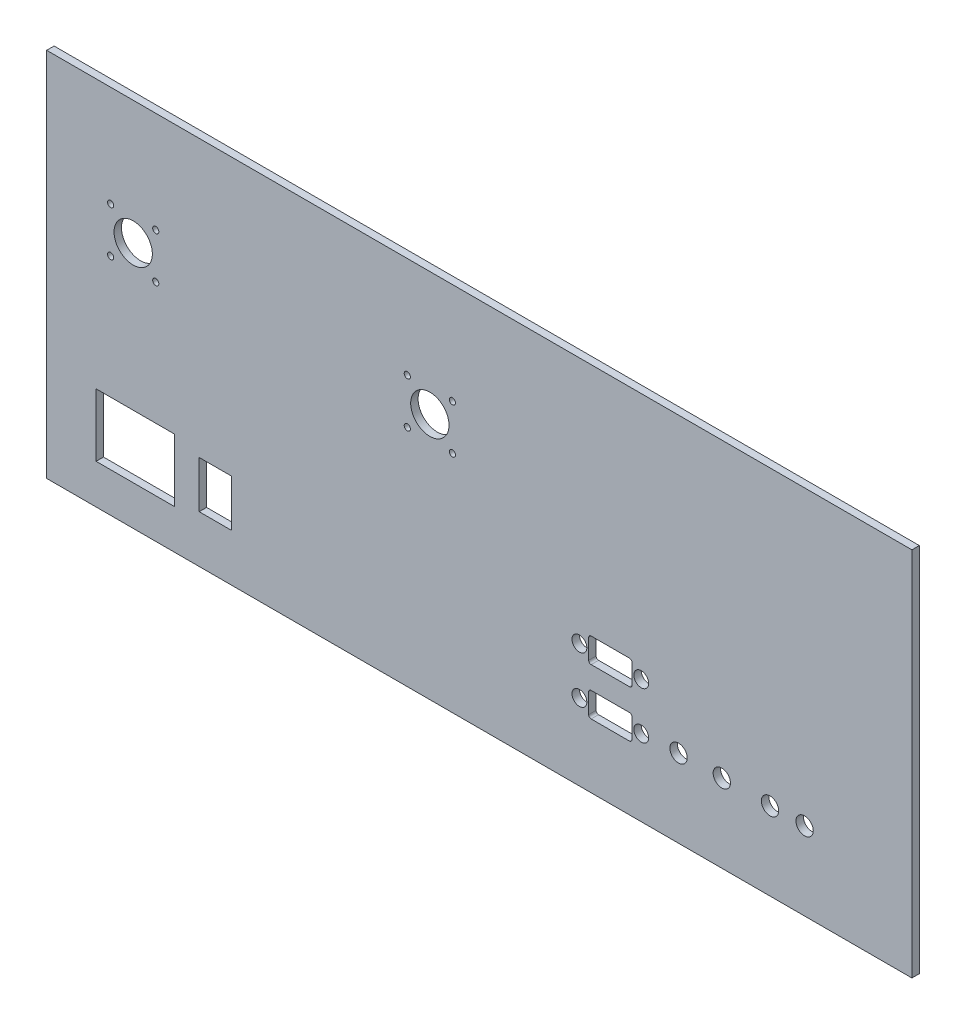
from build123d import *

# Parameters (mm, degrees)
SKETCH_2_W          = 350
SKETCH_2_H          = 150
EXTRUDE_1_DEPTH     = 3
SKETCH_3_R          = 3
SKETCH_3_R_2        = 3.5
SKETCH_3_R_3        = 1.25
SKETCH_3_R_4        = 7.75
SKETCH_3_W          = 31.7
SKETCH_3_H          = 25.4
SKETCH_3_W_2        = 13
SKETCH_3_H_2        = 19
CUT_EXTRUDE_1_DEPTH = 231.508134347


with BuildPart() as part:
    # 草图2 → 凸台-拉伸1 (new body)
    with BuildSketch(Plane.XY):
        with Locations((0, 75)):
            Rectangle(SKETCH_2_W, SKETCH_2_H)
    extrude(amount=EXTRUDE_1_DEPTH)

    # 草图3 → 切除-拉伸1 (cut, through all)
    with BuildSketch(Plane.XY.offset(3)):
        with Locations((40.5, 30.875)):
            Circle(SKETCH_3_R)
        with Locations((65.5, 30.875)):
            Circle(SKETCH_3_R)
        with Locations((80.6, 31.6)):
            Circle(SKETCH_3_R_2)
        with Locations((98.1, 31.6)):
            Circle(SKETCH_3_R_2)
        with Locations((117.6, 31.6)):
            Circle(SKETCH_3_R_2)
        with Locations((131.6, 31.6)):
            Circle(SKETCH_3_R_2)
        with Locations((-149.12, 109.12)):
            Circle(SKETCH_3_R_3)
        with Locations((-130.88, 109.12)):
            Circle(SKETCH_3_R_3)
        with Locations((-149.12, 90.88)):
            Circle(SKETCH_3_R_3)
        with Locations((-130.88, 90.88)):
            Circle(SKETCH_3_R_3)
        with Locations((-140, 100)):
            Circle(SKETCH_3_R_4)
        with Locations((-29.12, 90.88)):
            Circle(SKETCH_3_R_3)
        with Locations((-10.88, 90.88)):
            Circle(SKETCH_3_R_3)
        with Locations((-20, 100)):
            Circle(SKETCH_3_R_4)
        with Locations((-29.12, 109.12)):
            Circle(SKETCH_3_R_3)
        with Locations((-10.88, 109.12)):
            Circle(SKETCH_3_R_3)
        with Locations((65.5, 49.925)):
            Circle(SKETCH_3_R)
        with Locations((40.5, 49.925)):
            Circle(SKETCH_3_R)
        with BuildLine():
            Line((61.75, 45.925), (61.75, 53.925))
            ThreePointArc((61.75, 53.925), (61.457106781, 54.632106781), (60.75, 54.925))
            Line((60.75, 54.925), (45.25, 54.925))
            ThreePointArc((45.25, 54.925), (44.542893219, 54.632106781), (44.25, 53.925))
            Line((44.25, 53.925), (44.25, 45.925))
            ThreePointArc((44.25, 45.925), (44.542893219, 45.217893219), (45.25, 44.925))
            Line((45.25, 44.925), (60.75, 44.925))
            ThreePointArc((60.75, 44.925), (61.457106781, 45.217893219), (61.75, 45.925))
        make_face()
        with BuildLine():
            Line((45.25, 25.875), (60.75, 25.875))
            ThreePointArc((60.75, 25.875), (61.457106781, 26.167893219), (61.75, 26.875))
            Line((61.75, 26.875), (61.75, 34.875))
            ThreePointArc((61.75, 34.875), (61.457106781, 35.582106781), (60.75, 35.875))
            Line((60.75, 35.875), (45.25, 35.875))
            ThreePointArc((45.25, 35.875), (44.542893219, 35.582106781), (44.25, 34.875))
            Line((44.25, 34.875), (44.25, 26.875))
            ThreePointArc((44.25, 26.875), (44.542893219, 26.167893219), (45.25, 25.875))
        make_face()
        with Locations((-139.15, 28.7)):
            Rectangle(SKETCH_3_W, SKETCH_3_H)
        with Locations((-106.8, 28.7)):
            Rectangle(SKETCH_3_W_2, SKETCH_3_H_2)
    extrude(amount=-CUT_EXTRUDE_1_DEPTH, mode=Mode.SUBTRACT)


solid = part.part
